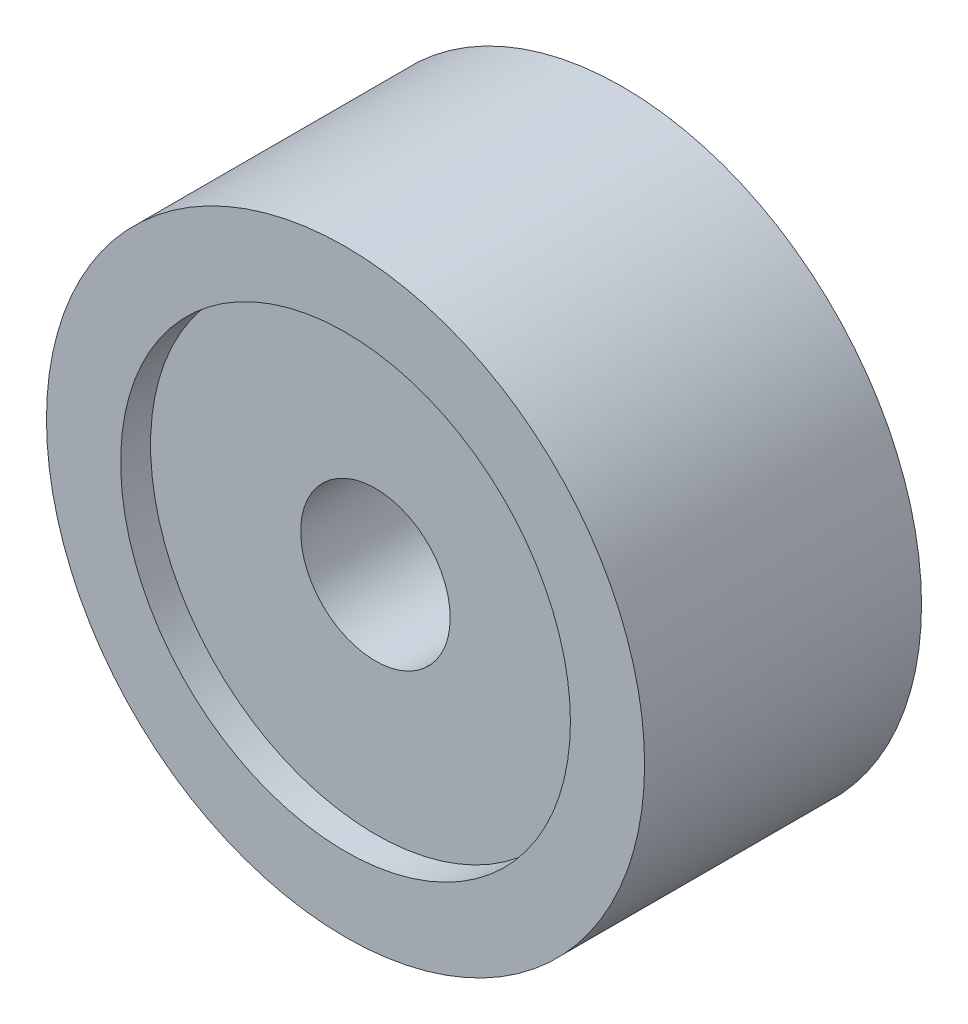
from build123d import *

# Parameters (mm, degrees)
SKETCH1_R          = 12.7
SKETCH1_R_2        = 3.175
EXTRUDE1_DEPTH     = 11.7602
SKETCH2_R          = 9.55
CUT_EXTRUDE1_DEPTH = 1.27


with BuildPart() as part:
    # Sketch1 → Extrude1 (new body)
    with BuildSketch(Plane.XY):
        Circle(SKETCH1_R)
        Circle(SKETCH1_R_2, mode=Mode.SUBTRACT)
    extrude(amount=-EXTRUDE1_DEPTH)

    # Sketch2 → Cut-Extrude1 (cut)
    with BuildSketch(Plane.XY):
        Circle(SKETCH2_R)
    extrude(amount=-CUT_EXTRUDE1_DEPTH, mode=Mode.SUBTRACT)


solid = part.part
